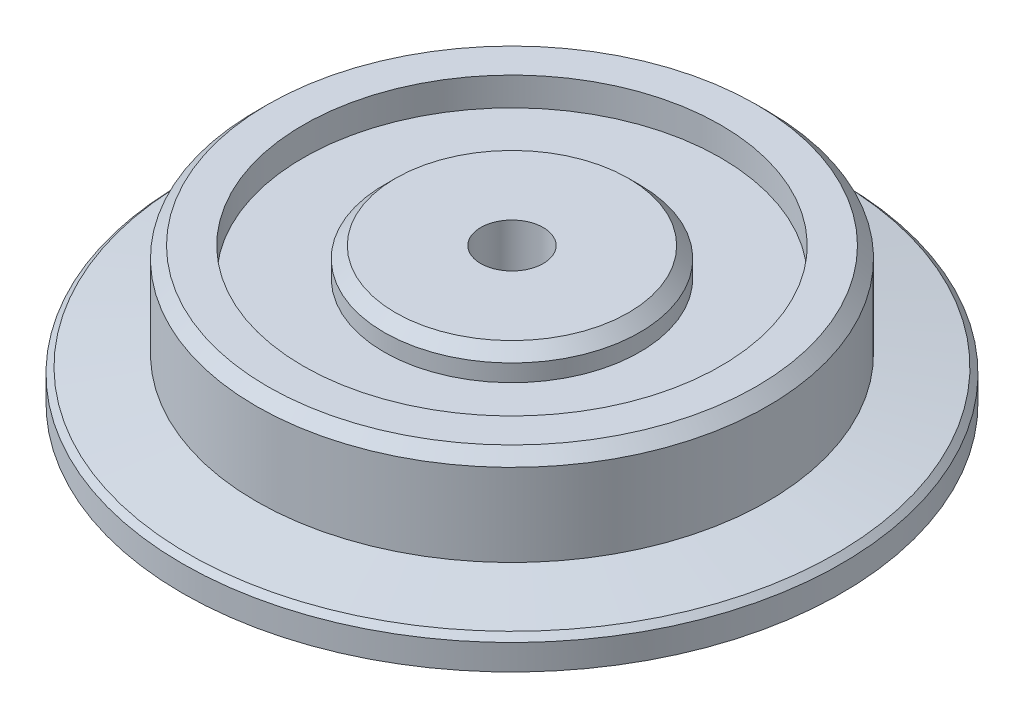
from build123d import *

# Parameters (mm, degrees)
SKETCH_4_R          = 11.6
SKETCH_4_R_2        = 1.1
EXTRUDE_1_DEPTH     = 1.1
EXTRUDE_START       = 1.5
SKETCH_4_3_R        = 9
SKETCH_4_3_R_2      = 1.1
EXTRUDE_2_DEPTH     = 3.3
CHAMFER_1_SIZE      = 0.2
SKETCH_6_R          = 7.35
SKETCH_6_R_2        = 4.5
CUT_EXTRUDE_1_DEPTH = 1
CHAMFER_2_SIZE      = 0.4
SKETCH_4_4_R        = 1.1
CUT_EXTRUDE_2_DEPTH = 18.092688495
CHAMFER_3_SIZE      = 0.5


with BuildPart() as part:
    # 草图4 → 凸台-拉伸1 (new body)
    with BuildSketch(Plane(origin=(0, 0, 0), x_dir=(1, 0, 0), z_dir=(0, 1, 0))):
        Circle(SKETCH_4_R)
        Circle(SKETCH_4_R_2, mode=Mode.SUBTRACT)
    extrude(amount=EXTRUDE_1_DEPTH)

    # 倒角1
    chamfer_1_edges = [part.edges().sort_by_distance(p)[0] for p in [
        (-11.6, 1.1, 0),
    ]]
    chamfer(chamfer_1_edges, length=CHAMFER_1_SIZE)


with BuildPart() as body_2:
    # 草图4<3> → 凸台-拉伸2 (new body)
    with BuildSketch(Plane(origin=(0, 0, 0), x_dir=(1, 0, 0), z_dir=(0, 1, 0)).offset(EXTRUDE_START)):
        Circle(SKETCH_4_3_R)
        Circle(SKETCH_4_3_R_2, mode=Mode.SUBTRACT)
    extrude(amount=EXTRUDE_2_DEPTH)


    add(part.part)  # loft_1 joins it to this body
    # loft up to a face of the part (loft_1)
    loft([Face(Wire([body_2.edges().sort_by_distance((-6.160923953, 1.5, 6.560717647))[0]])), Face(Wire([body_2.edges().sort_by_distance((-7.803837008, 1.1, -8.310242353))[0]]))])

    # 草图6 → 切除-拉伸1 (cut)
    with BuildSketch(Plane(origin=(0, 4.8, 0), x_dir=(1, 0, 0), z_dir=(0, 1, 0))):
        Circle(SKETCH_6_R)
        Circle(SKETCH_6_R_2, mode=Mode.SUBTRACT)
    extrude(amount=-CUT_EXTRUDE_1_DEPTH, mode=Mode.SUBTRACT)

    # 倒角2
    chamfer_2_edges = [body_2.edges().sort_by_distance(p)[0] for p in [
        (-4.5, 4.8, 0),
        (-9, 4.8, 0),
    ]]
    chamfer(chamfer_2_edges, length=CHAMFER_2_SIZE)

    # 草图4<4> → 切除-拉伸2 (cut, through all)
    with BuildSketch(Plane(origin=(0, 0, 0), x_dir=(1, 0, 0), z_dir=(0, 1, 0))):
        Circle(SKETCH_4_4_R)
    extrude(amount=CUT_EXTRUDE_2_DEPTH, mode=Mode.SUBTRACT)

    # 倒角3
    chamfer_3_edges = [body_2.edges().sort_by_distance(p)[0] for p in [
        (-1.1, 0, 0),
    ]]
    chamfer(chamfer_3_edges, length=CHAMFER_3_SIZE)


solid = body_2.part
